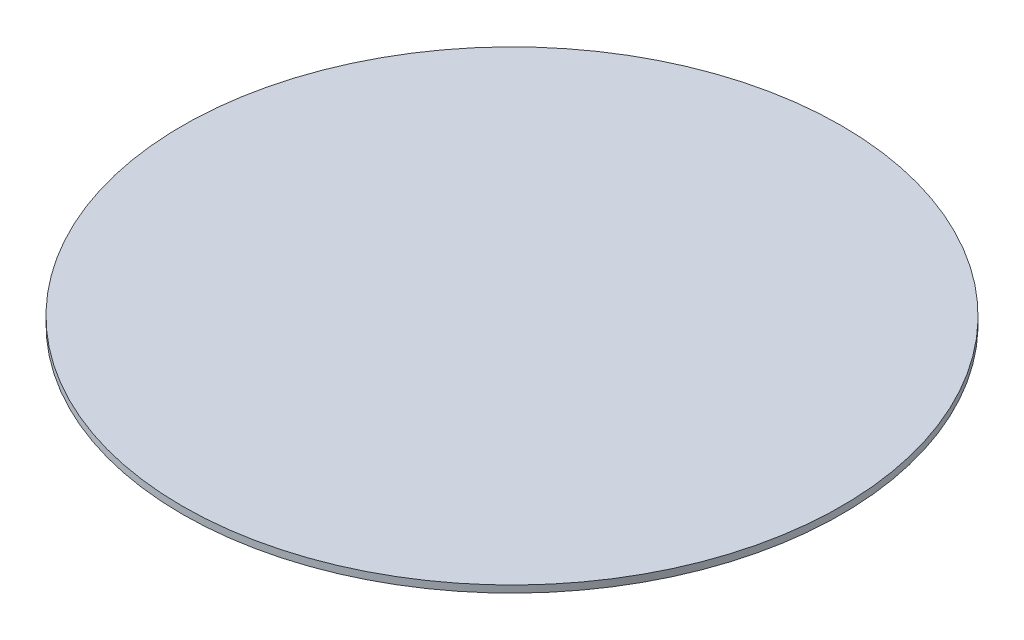
from build123d import *

# Parameters (mm, degrees)
SKETCH1_R           = 60
BOSS_EXTRUDE1_DEPTH = 1.28


with BuildPart() as part:
    # Sketch1 → Boss-Extrude1 (new body)
    with BuildSketch(Plane(origin=(0, 0, 0), x_dir=(1, 0, 0), z_dir=(0, 1, 0))):
        with Locations(Location((0, 0, 0), (0, 0, 90))):
            Circle(SKETCH1_R)
    extrude(amount=BOSS_EXTRUDE1_DEPTH)


solid = part.part
